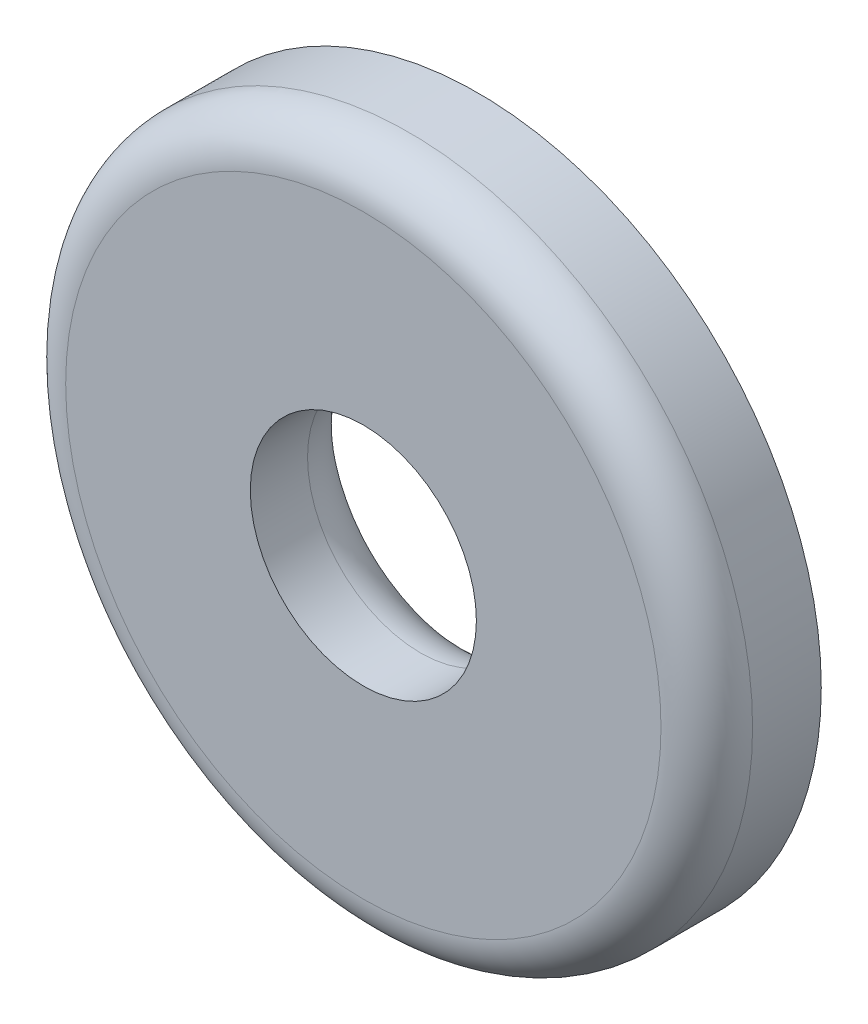
from build123d import *

# Parameters (mm, degrees)
SKETCH10_R          = 30
SKETCH10_R_2        = 9.875
BOSS_EXTRUDE4_DEPTH = 10
FILLET1_R           = 4
FILLET2_R           = 5


with BuildPart() as part:
    # Sketch10 → Boss-Extrude4 (new body)
    with BuildSketch(Plane.XY):
        with Locations((-81.433006588, 0)):
            Circle(SKETCH10_R)
        with Locations((-81.433006588, 0)):
            Circle(SKETCH10_R_2, mode=Mode.SUBTRACT)
    extrude(amount=BOSS_EXTRUDE4_DEPTH)

    # Fillet1
    fillet1_edges = [part.edges().sort_by_distance(p)[0] for p in [
        (-111.433006588, 0, 10),
    ]]
    fillet(fillet1_edges, radius=FILLET1_R)

    # Fillet2
    fillet2_edges = [part.edges().sort_by_distance(p)[0] for p in [
        (-91.308006588, 0, 0),
    ]]
    fillet(fillet2_edges, radius=FILLET2_R)


solid = part.part
